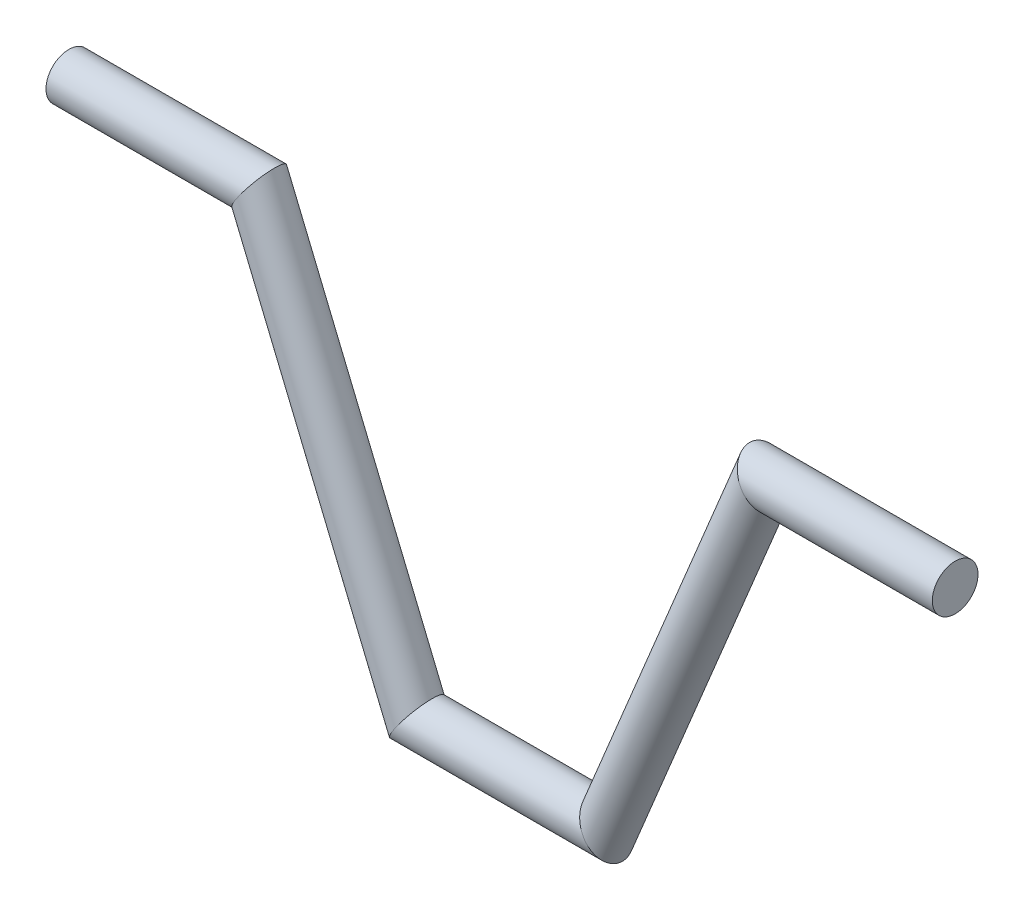
from build123d import *

# Parameters (mm, degrees)
SKETCH2_R = 3


with BuildPart() as part:
    # Sweep3: sweep along a path in Sketch1
    with BuildLine(Plane.XY) as sweep3_path:
        Line((-58.210678119, 50), (-33.210678119, 50))
        Line((-33.210678119, 50), (-12.5, 0))
        Line((-12.5, 0), (12.5, 0))
        Line((12.5, 0), (33.210678119, 50))
        Line((33.210678119, 50), (58.210678119, 50))
    # Sketch2 → Sweep3 (sweep)
    with BuildSketch(Plane(origin=(49, 0, 0), x_dir=(0, 0, -1), z_dir=(1, 0, 0))):
        with Locations((0, 50)):
            Circle(SKETCH2_R)
    sweep(path=sweep3_path.line, transition=Transition.RIGHT)


solid = part.part
